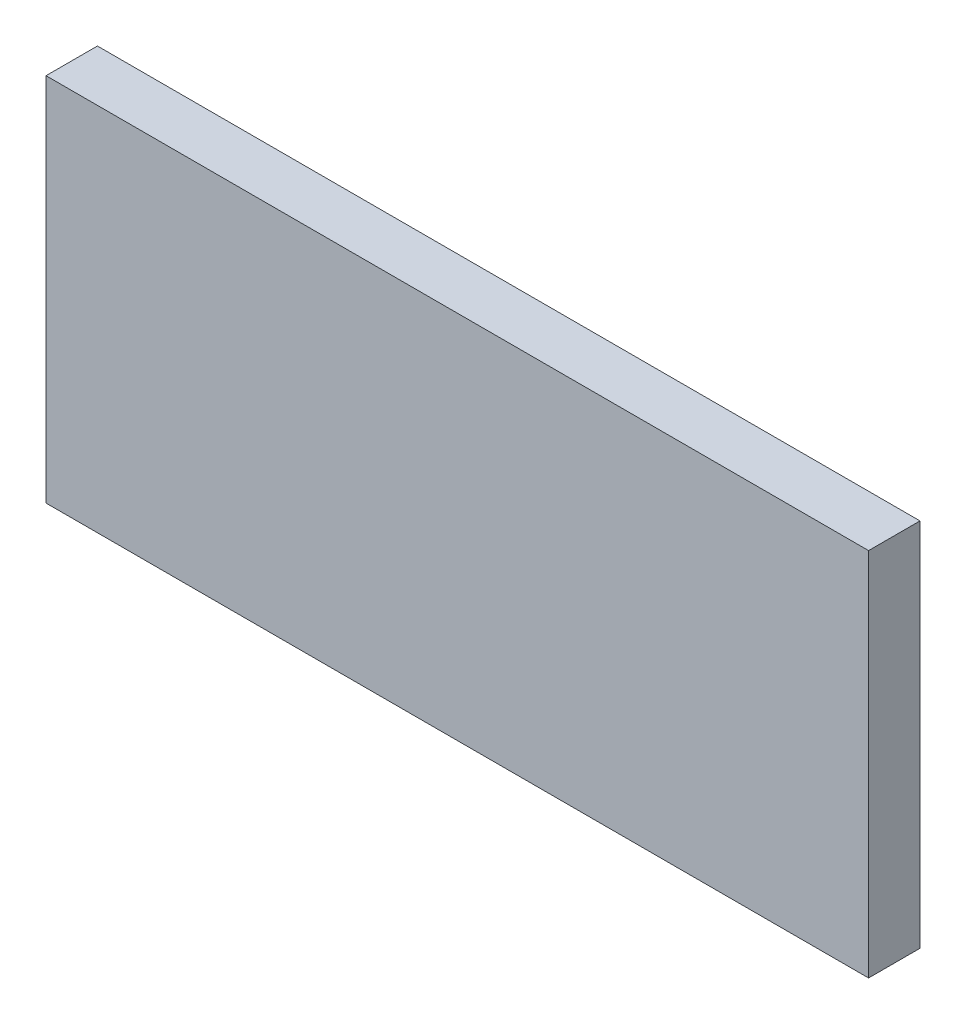
from build123d import *

# Parameters (mm, degrees)
SKETCH1_W           = 80
SKETCH1_H           = 36
BOSS_EXTRUDE1_DEPTH = 5
SKETCH2_W           = 71
SKETCH2_H           = 23.8
BOSS_EXTRUDE2_DEPTH = 2


with BuildPart() as part:
    # Sketch1 → Boss-Extrude1 (new body)
    with BuildSketch(Plane.XY):
        with Locations((-0.069841539, 43.169841539)):
            Rectangle(SKETCH1_W, SKETCH1_H)
    extrude(amount=BOSS_EXTRUDE1_DEPTH)

    # Sketch2 → Boss-Extrude2 (add)
    with BuildSketch(Plane(origin=(0, 0, 0), x_dir=(-1, 0, 0), z_dir=(0, 0, -1))):
        with Locations((0, 43.1)):
            Rectangle(SKETCH2_W, SKETCH2_H)
    extrude(amount=BOSS_EXTRUDE2_DEPTH)


solid = part.part
